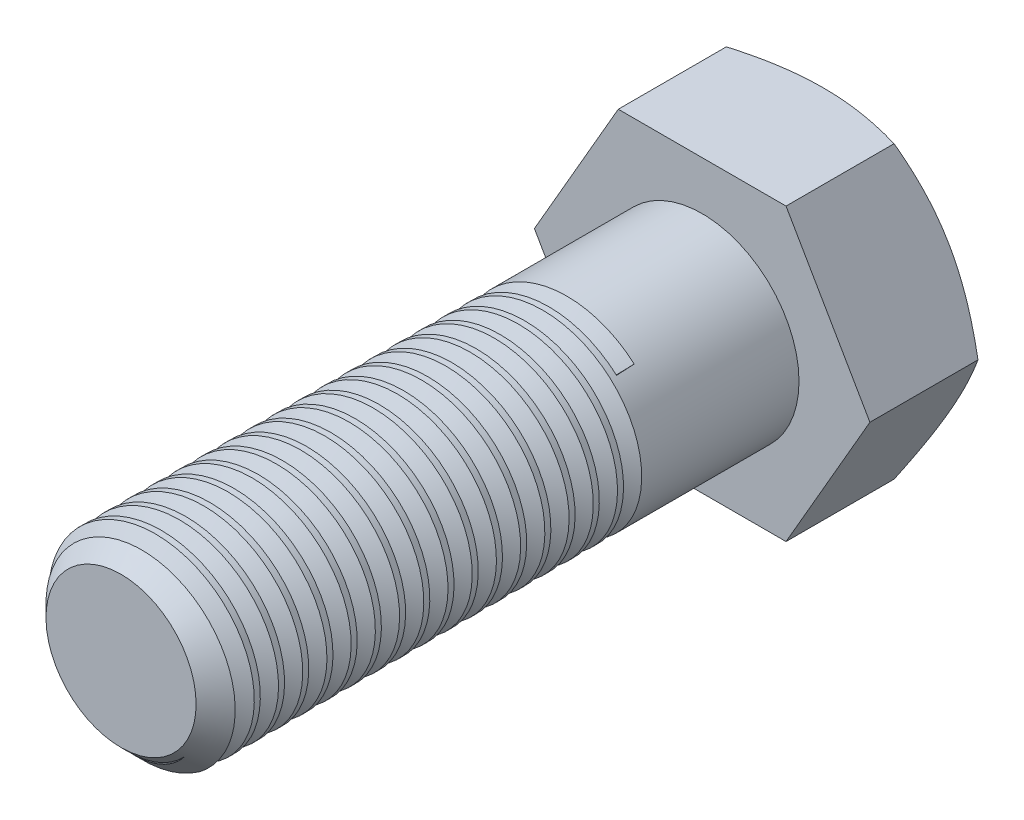
from build123d import *

# Parameters (mm, degrees)
Y_KSEKLIK_EKSTR_ZYON1_DEPTH = 12.5
IZIM2_OUTSIDE_W             = 89.444
IZIM2_OUTSIDE_H             = 84.802
IZIM2_OUTSIDE_R             = 15
KES_EKSTR_ZYON1_DEPTH       = 12.5
KES_EKSTR_ZYON1_DRAFT       = -60
IZIM3_R                     = 10
Y_KSEKLIK_EKSTR_ZYON2_DEPTH = 60
PAH1_SIZE                   = 2.25
KES_S_P_R1_PITCH            = 2.5
KES_S_P_R1_HEIGHT           = 45
KES_S_P_R1_RADIUS           = 10
KES_S_P_R1_START_ANGLE      = 135


with BuildPart() as part:
    # Çizim1 → Yükseklik-Ekstrüzyon1 (new body)
    with BuildSketch(Plane.XY):
        Polygon((17.320508076, 0), (8.660254038, 15), (-8.660254038, 15), (-17.320508076, 0), (-8.660254038, -15), (8.660254038, -15), align=None)
    extrude(amount=Y_KSEKLIK_EKSTR_ZYON1_DEPTH)


with BuildPart() as kes_ekstr_zyon1_tool:
    # Çizim2 outside → Kes-Ekstrüzyon1 (with draft: the straight prism first)
    with BuildSketch(Plane(origin=(0, 0, 0), x_dir=(-1, 0, 0), z_dir=(0, 0, -1))):
        Rectangle(IZIM2_OUTSIDE_W, IZIM2_OUTSIDE_H)
        Circle(IZIM2_OUTSIDE_R, mode=Mode.SUBTRACT)
    extrude(amount=-KES_EKSTR_ZYON1_DEPTH)
    # Kes-Ekstrüzyon1: the draft: its side faces are tilted about the plane it starts from
    kes_ekstr_zyon1_sides = [kes_ekstr_zyon1_tool.faces().sort_by_distance(p)[0] for p in [
        (0, -42.401, 6.25),
        (-44.722, 0, 6.25),
        (0, 42.401, 6.25),
        (44.722, 0, 6.25),
        (15, 0, 6.25),
    ]]
    draft(kes_ekstr_zyon1_sides, Plane(origin=(0, 0, 0), x_dir=(-1, 0, 0), z_dir=(0, 0, -1)), KES_EKSTR_ZYON1_DRAFT)


with BuildPart() as part_1:
    add(part.part)

    # Kes-Ekstrüzyon1: cut by kes_ekstr_zyon1_tool
    add(kes_ekstr_zyon1_tool.part, mode=Mode.SUBTRACT)

    # Çizim3 → Yükseklik-Ekstrüzyon2 (add)
    with BuildSketch(Plane.XY.offset(12.5)):
        Circle(IZIM3_R)
    extrude(amount=Y_KSEKLIK_EKSTR_ZYON2_DEPTH)

    # Pah1
    pah1_edges = [part_1.edges().sort_by_distance(p)[0] for p in [
        (-10, 0, 72.5),
    ]]
    chamfer(pah1_edges, length=PAH1_SIZE)

    # Kes-Süpür1: sweep along a helix
    with BuildLine() as kes_s_p_r1_path:
        add(Helix(KES_S_P_R1_PITCH, KES_S_P_R1_HEIGHT, KES_S_P_R1_RADIUS, center=(0, 0, 72.5), direction=(0, 0, -1), mode=Mode.PRIVATE).rotate(Axis((0, 0, 72.5), (0, 0, -1)), KES_S_P_R1_START_ANGLE))
    # Çizim5 → Kes-Süpür1 (sweep, cut)
    with BuildSketch(Plane(origin=(7.071067812, 7.071067812, 72.5), x_dir=(-0.028112640508469643, 0.028112640508469563, -0.9992093668932869), z_dir=(0.7065477191553611, -0.7065477191553592, -0.03975727748119698))):
        Polygon((1.116278103, 0.30845039), (-1.116278103, 0.30845039), (0, -1.625), align=None)
    sweep(path=kes_s_p_r1_path.line, is_frenet=True, mode=Mode.SUBTRACT)


solid = part_1.part
